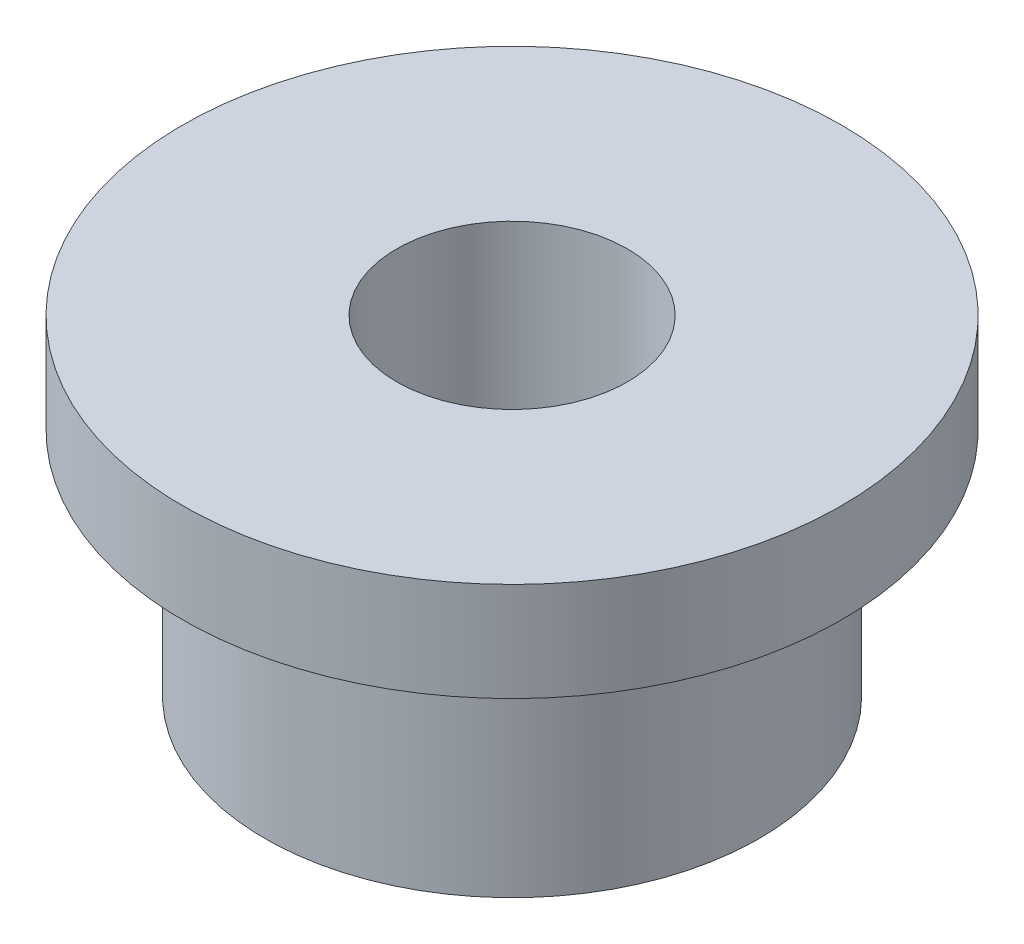
from build123d import *


with BuildPart() as part:
    # Sketch1 → Revolve1 (revolve)
    with BuildSketch(Plane.XY, mode=Mode.PRIVATE) as revolve1_sk:
        Polygon((3.5, 10), (3.5, 0), (7.5, 0), (7.5, 7), (10, 7), (10, 10), align=None)
    revolve(revolve1_sk.sketch.rotate(Axis((0, 0, 0), (0, 1, 0)), 90), axis=Axis((0, 0, 0), (0, 1, 0)))


solid = part.part
